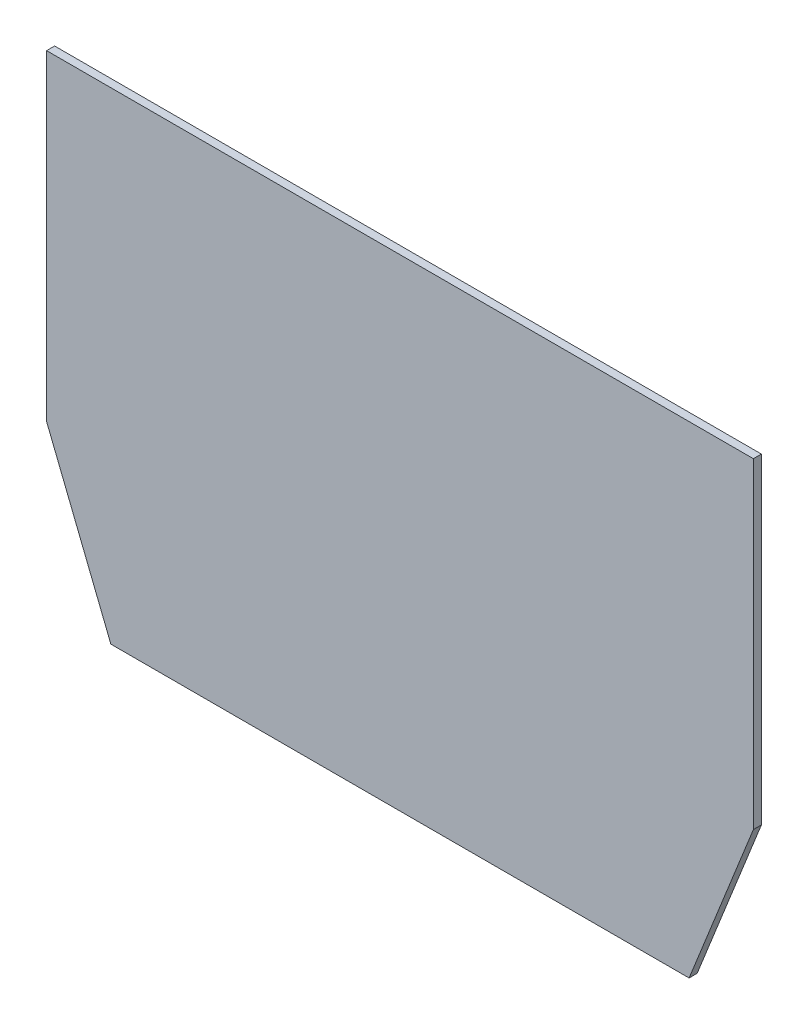
from build123d import *

# Parameters (mm, degrees)
BOSS_EXTRUDE1_DEPTH = 3.175


with BuildPart() as part:
    # Sketch1 → Boss-Extrude1 (new body)
    with BuildSketch(Plane.XY):
        Polygon((25.4, 0), (254, 0), (279.4, 63.5), (279.4, 190.5), (0, 190.5), (0, 63.5), align=None)
    extrude(amount=BOSS_EXTRUDE1_DEPTH)


solid = part.part
